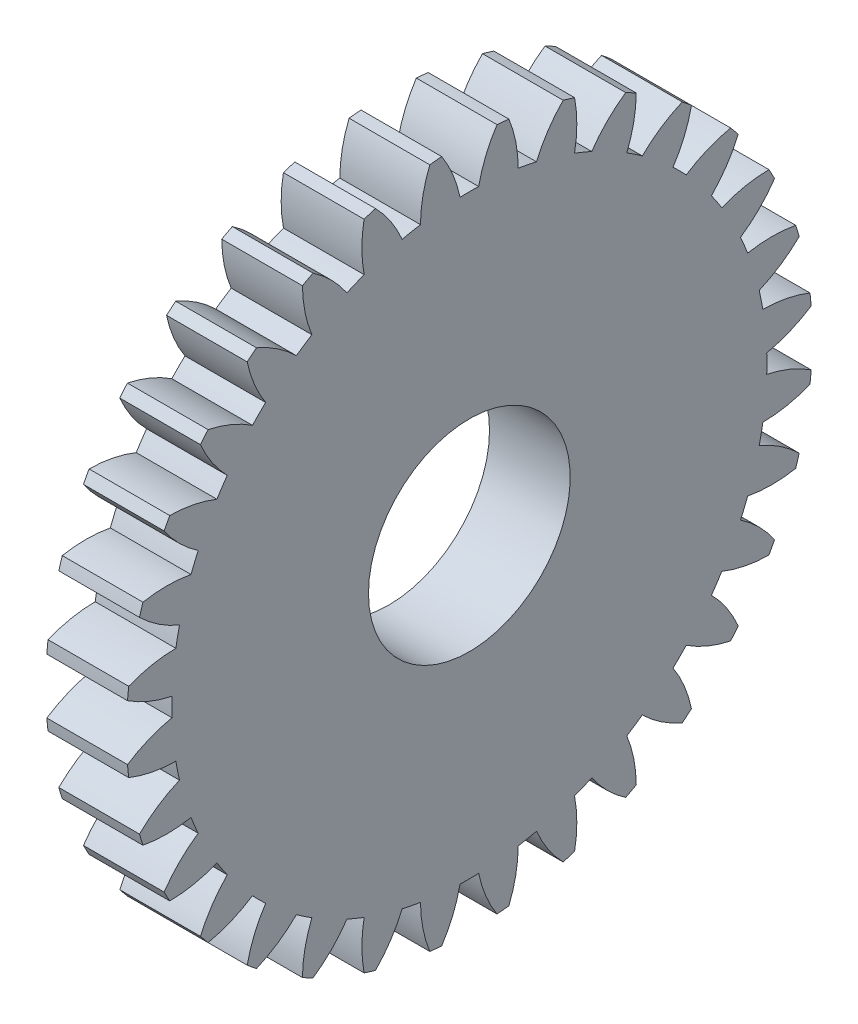
from build123d import *

# Parameters (mm, degrees)
BASPROSKE_W     = 4
BASPROSKE_H     = 17
TOOTHCUT_DEPTH  = 25.372115214
TEETHCUTS_COUNT = 32
TEETHCUTS_ANGLE = 348.75
BORSKE_R        = 5
BORE_DEPTH      = 50.0000508


with BuildPart() as part:
    # BasProSke → Base-Revolve (revolve)
    with BuildSketch(Plane(origin=(0, 0, 0), x_dir=(1, 0, 0), z_dir=(0, 1, 0)), mode=Mode.PRIVATE) as base_revolve_sk:
        with Locations((2, 8.5)):
            Rectangle(BASPROSKE_W, BASPROSKE_H)
    revolve(base_revolve_sk.sketch.rotate(Axis((-10, 0, 0), (1, 0, 0)), 180), axis=Axis((-10, 0, 0), (1, 0, 0)))

    # TooCutSke → ToothCut (cut, through all)
    with BuildSketch(Plane(origin=(0, 0, 0), x_dir=(0, 0, -1), z_dir=(1, 0, 0))):
        with BuildLine():
            ThreePointArc((0.462036907, 14.741761187), (0, 14.749), (-0.462036907, 14.741761187))
            ThreePointArc((-0.462036907, 14.741761187), (-0.81854142, 15.899240468), (-1.386721275, 16.9688317))
            ThreePointArc((-1.386721275, 16.9688317), (0, 17.0254), (1.386721275, 16.9688317))
            ThreePointArc((1.386721275, 16.9688317), (0.81854142, 15.899240468), (0.462036907, 14.741761187))
        make_face()
    toothcut = extrude(amount=TOOTHCUT_DEPTH, mode=Mode.SUBTRACT)

    # TeethCuts: ToothCut ×32 about axis
    teethcuts_axis = Axis((-10, 0, 0), (1, 0, 0))
    for i in range(1, TEETHCUTS_COUNT):
        add(toothcut.rotate(teethcuts_axis, i * TEETHCUTS_ANGLE / (TEETHCUTS_COUNT - 1)), mode=Mode.SUBTRACT)

    # BorSke → Bore (cut, symmetric)
    with BuildSketch(Plane(origin=(0, 0, 0), x_dir=(0, 0, -1), z_dir=(1, 0, 0))):
        with Locations(Location((0, 0, 0), (0, 0, 180))):
            Circle(BORSKE_R)
    extrude(amount=BORE_DEPTH, both=True, mode=Mode.SUBTRACT)


solid = part.part
